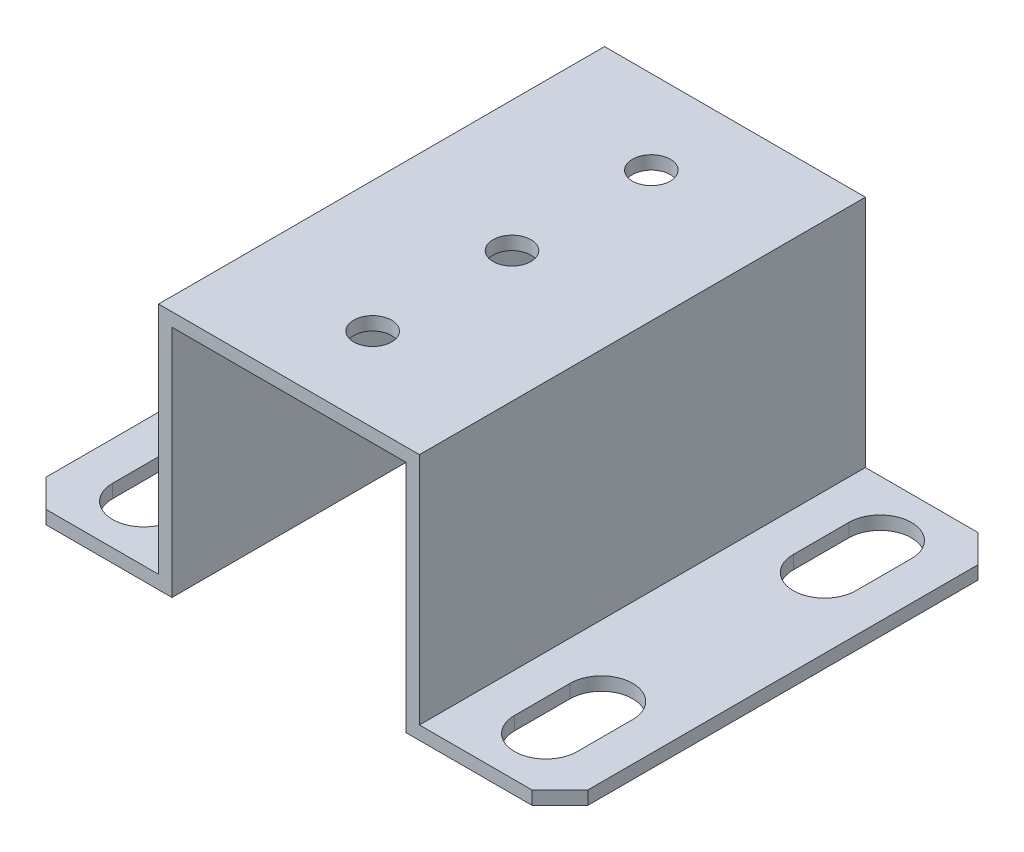
from build123d import *

# Parameters (mm, degrees)
BOSS_EXTRUDE1_DEPTH = 25.4
SKETCH3_R           = 2.159
CUT_EXTRUDE3_DEPTH  = 49.912809743
CUT_EXTRUDE4_DEPTH  = 49.050496574
CHAMFER1_SIZE       = 3.175


with BuildPart() as part:
    # Sketch2 → Boss-Extrude1 (new, symmetric)
    with BuildSketch(Plane.XY):
        Polygon((-14.859, 0), (-14.225031823, 0), (14.859, 0), (14.859, -26.67), (30.861, -26.67), (30.861, -28.194), (13.335, -28.194), (13.335, -1.524), (-13.335, -1.524), (-13.335, -28.194), (-30.861, -28.194), (-30.861, -26.67), (-14.859, -26.67), align=None)
    extrude(amount=BOSS_EXTRUDE1_DEPTH, both=True)

    # Sketch3 → Cut-Extrude3 (cut, through all)
    with BuildSketch(Plane(origin=(0, 0, 0), x_dir=(1, 0, 0), z_dir=(0, 1, 0))):
        with Locations(Location((0, -15.875, 0), (0, 0, 270))):
            Circle(SKETCH3_R)
        with Locations(Location((0, 15.875, 0), (0, 0, 270))):
            Circle(SKETCH3_R)
        with Locations(Location((0, 0, 0), (0, 0, 270))):
            Circle(SKETCH3_R)
    extrude(amount=-CUT_EXTRUDE3_DEPTH, mode=Mode.SUBTRACT)

    # Sketch9 → Cut-Extrude4 (cut, through all)
    with BuildSketch(Plane(origin=(0, -26.67, 0), x_dir=(1, 0, 0), z_dir=(0, 1, 0))):
        with BuildLine():
            Line((26.4668, 19.0373), (26.4668, 12.7127))
            ThreePointArc((26.4668, 12.7127), (22.8981, 9.144), (19.3294, 12.7127))
            Line((19.3294, 12.7127), (19.3294, 19.0373))
            ThreePointArc((19.3294, 19.0373), (22.8981, 22.606), (26.4668, 19.0373))
        make_face()
        with BuildLine():
            Line((-26.4668, 19.0373), (-26.4668, 12.7127))
            ThreePointArc((-26.4668, 12.7127), (-22.8981, 9.144), (-19.3294, 12.7127))
            Line((-19.3294, 12.7127), (-19.3294, 19.0373))
            ThreePointArc((-19.3294, 19.0373), (-22.8981, 22.606), (-26.4668, 19.0373))
        make_face()
        with BuildLine():
            Line((26.4668, -19.0373), (26.4668, -12.7127))
            ThreePointArc((26.4668, -12.7127), (22.8981, -9.144), (19.3294, -12.7127))
            Line((19.3294, -12.7127), (19.3294, -19.0373))
            ThreePointArc((19.3294, -19.0373), (22.8981, -22.606), (26.4668, -19.0373))
        make_face()
        with BuildLine():
            Line((-26.4668, -19.0373), (-26.4668, -12.7127))
            ThreePointArc((-26.4668, -12.7127), (-22.8981, -9.144), (-19.3294, -12.7127))
            Line((-19.3294, -12.7127), (-19.3294, -19.0373))
            ThreePointArc((-19.3294, -19.0373), (-22.8981, -22.606), (-26.4668, -19.0373))
        make_face()
    extrude(amount=-CUT_EXTRUDE4_DEPTH, mode=Mode.SUBTRACT)

    # Chamfer1
    chamfer1_edges = [part.edges().sort_by_distance(p)[0] for p in [
        (-30.861, -27.432, 25.4),
        (30.861, -27.432, -25.4),
        (-30.861, -27.432, -25.4),
        (30.861, -27.432, 25.4),
    ]]
    chamfer(chamfer1_edges, length=CHAMFER1_SIZE)


solid = part.part
